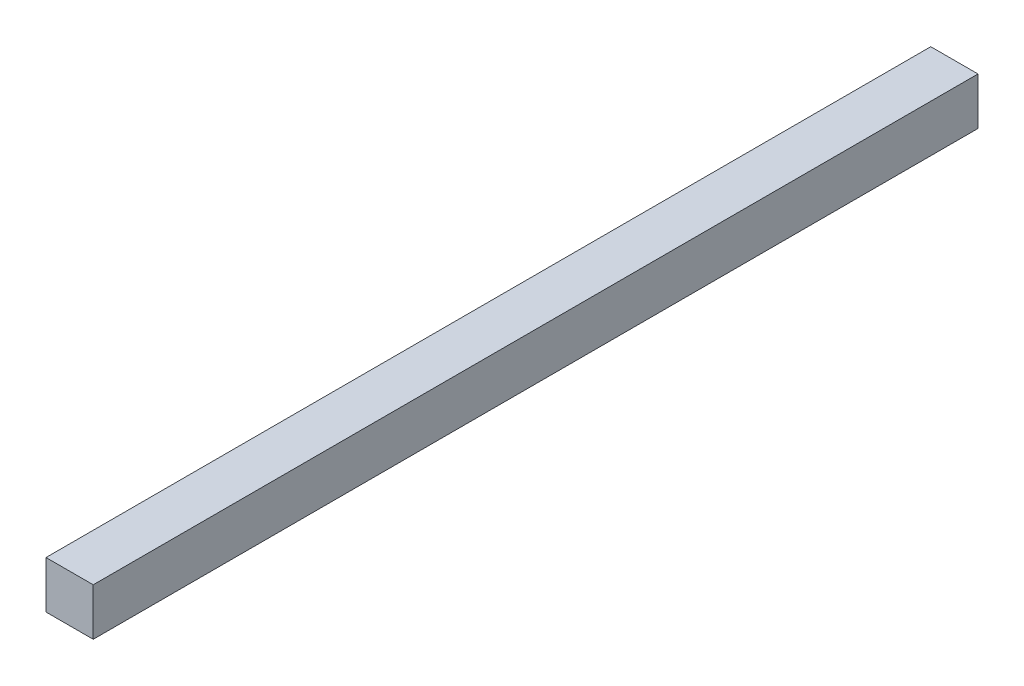
from build123d import *

# Parameters (mm, degrees)
SKETCH_1_W      = 30
SKETCH_1_H      = 30
EXTRUDE_1_DEPTH = 281


with BuildPart() as part:
    # 草图1 → 凸台-拉伸1 (new, symmetric)
    with BuildSketch(Plane.XY):
        Rectangle(SKETCH_1_W, SKETCH_1_H)
    extrude(amount=EXTRUDE_1_DEPTH, both=True)


solid = part.part
